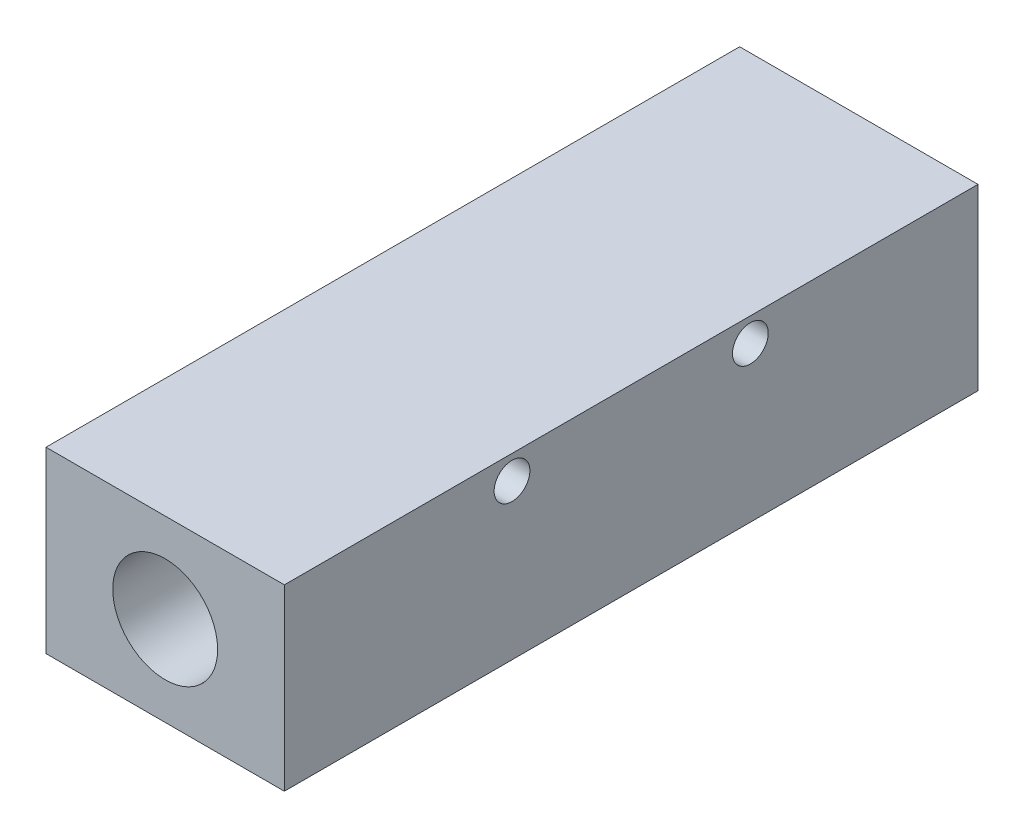
from build123d import *

# Parameters (mm, degrees)
SCHIZZO1_W                   = 20
SCHIZZO1_H                   = 15
ESTRUSIONE_ESTRUSIONE1_DEPTH = 58.2
SCHIZZO2_R                   = 3
TAGLIO_ESTRUSIONE1_DEPTH     = 60.527220664
SCHIZZO3_R                   = 6.75
TAGLIO_ESTRUSIONE2_DEPTH     = 13
SCHIZZO4_R                   = 1.5
TAGLIO_ESTRUSIONE3_DEPTH     = 62.99588696
FORO_FILETTATO_G1_8_1_D      = 8.8
FORO_FILETTATO_G1_8_1_DEPTH  = 12.72
FORO_FILETTATO_G1_8_1_TIP    = 2.643786724


with BuildPart() as part:
    # Schizzo1 → Estrusione-Estrusione1 (new body)
    with BuildSketch(Plane.XY):
        Rectangle(SCHIZZO1_W, SCHIZZO1_H)
    extrude(amount=-ESTRUSIONE_ESTRUSIONE1_DEPTH)

    # Schizzo2 → Taglio-Estrusione1 (cut, through all)
    with BuildSketch(Plane(origin=(0, 0, -58.2), x_dir=(-1, 0, 0), z_dir=(0, 0, -1))):
        Circle(SCHIZZO2_R)
    extrude(amount=-TAGLIO_ESTRUSIONE1_DEPTH, mode=Mode.SUBTRACT)

    # Schizzo3 → Taglio-Estrusione2 (cut)
    with BuildSketch(Plane(origin=(0, 0, -58.2), x_dir=(-1, 0, 0), z_dir=(0, 0, -1))):
        Circle(SCHIZZO3_R)
    extrude(amount=-TAGLIO_ESTRUSIONE2_DEPTH, mode=Mode.SUBTRACT)

    # Schizzo4 → Taglio-Estrusione3 (cut, through all)
    with BuildSketch(Plane(origin=(10, 0, 0), x_dir=(0, 0, -1), z_dir=(1, 0, 0))):
        with Locations((19.1, 5.5)):
            Circle(SCHIZZO4_R)
        with Locations(Location((39.1, 5.5, 0), (0, 0, 180))):
            Circle(SCHIZZO4_R)
    extrude(amount=-TAGLIO_ESTRUSIONE3_DEPTH, mode=Mode.SUBTRACT)

    # Foro filettato G1/8-1
    with Locations(Plane.XY):
        with Locations((0, 0)):
            Hole(FORO_FILETTATO_G1_8_1_D / 2, depth=FORO_FILETTATO_G1_8_1_DEPTH)
            with Locations((0, 0, -(FORO_FILETTATO_G1_8_1_DEPTH + FORO_FILETTATO_G1_8_1_TIP / 2))):  # 118° drill point
                Cone(0, FORO_FILETTATO_G1_8_1_D / 2, FORO_FILETTATO_G1_8_1_TIP, mode=Mode.SUBTRACT)


solid = part.part
